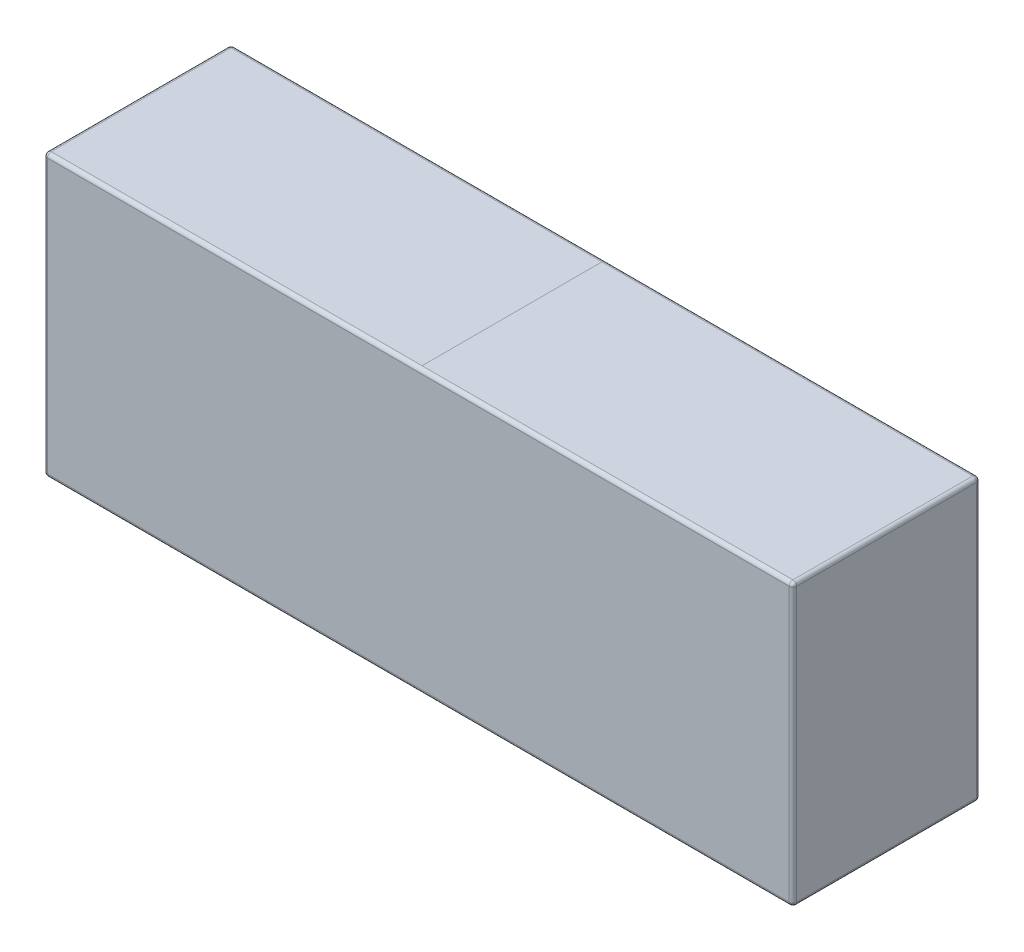
from build123d import *

# Parameters (mm, degrees)
CROQUIS3_W              = 40
CROQUIS3_H              = 15
SALIENTE_EXTRUIR1_DEPTH = 10
REDONDEO1_R             = 0.2


with BuildPart() as part:
    # Croquis3 → Saliente-Extruir1 (new body)
    with BuildSketch(Plane.XY):
        Rectangle(CROQUIS3_W, CROQUIS3_H)
    extrude(amount=SALIENTE_EXTRUIR1_DEPTH)

    # Redondeo1
    redondeo1_edges = [part.edges().sort_by_distance(p)[0] for p in [
        (-20, 0, 10),
        (0, -7.5, 10),
        (20, 0, 10),
        (0, -7.5, 0),
        (-20, 0, 0),
        (0, 7.5, 0),
        (20, 0, 0),
        (20, -7.5, 5),
        (-20, -7.5, 5),
        (-20, 7.5, 5),
        (20, 7.5, 5),
        (0, 7.5, 10),
    ]]
    fillet(redondeo1_edges, radius=REDONDEO1_R)


solid = part.part
